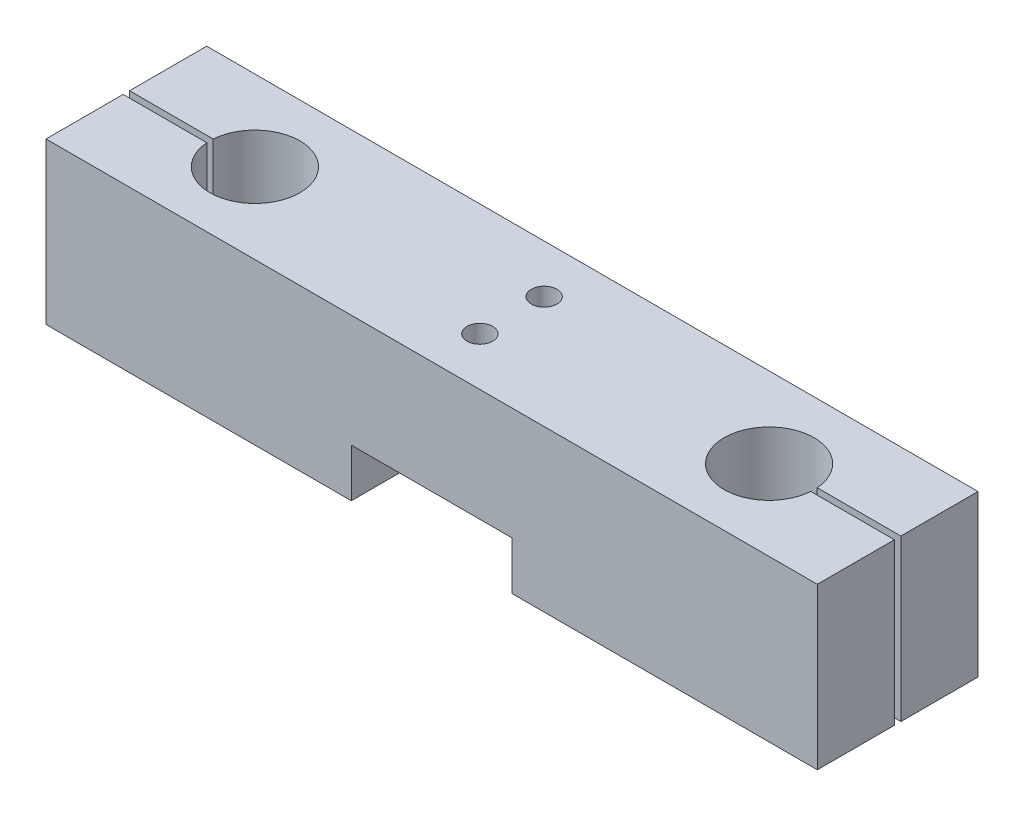
from build123d import *

# Parameters (mm, degrees)
EXTRUDE_1_DEPTH     = 50
SKETCH_3_W          = 50
SKETCH_3_H          = 50
CUT_EXTRUDE_1_DEPTH = 15
SKETCH_4_R          = 4
CUT_EXTRUDE_2_DEPTH = 50


with BuildPart() as part:
    # Эскиз1 → Бобышка-Вытянуть1 (new body)
    with BuildSketch(Plane(origin=(0, 0, 0), x_dir=(1, 0, 0), z_dir=(0, 1, 0))):
        with BuildLine():
            Line((0, 0), (240, 0))
            Line((240, 0), (240, 24))
            Line((240, 24), (213.964240044, 24))
            ThreePointArc((213.964240044, 24), (186, 25), (213.964240044, 26))
            Line((213.964240044, 26), (240, 26))
            Line((240, 26), (240, 50))
            Line((240, 50), (0, 50))
            Line((0, 50), (0, 26))
            Line((0, 26), (26.035759956, 26))
            ThreePointArc((26.035759956, 26), (54, 25), (26.035759956, 24))
            Line((26.035759956, 24), (0, 24))
            Line((0, 24), (0, 0))
        make_face()
    extrude(amount=EXTRUDE_1_DEPTH)

    # Эскиз3 → Вырез-Вытянуть1 (cut)
    with BuildSketch(Plane.XZ):
        with Locations((120, -25)):
            Rectangle(SKETCH_3_W, SKETCH_3_H)
    extrude(amount=-CUT_EXTRUDE_1_DEPTH, mode=Mode.SUBTRACT)

    # Эскиз4 → Вырез-Вытянуть2 (cut)
    with BuildSketch(Plane(origin=(0, 50, 0), x_dir=(1, 0, 0), z_dir=(0, 1, 0))):
        with Locations(Location((120, 35, 0), (0, 0, 270))):
            Circle(SKETCH_4_R)
        with Locations(Location((120, 15, 0), (0, 0, 270))):
            Circle(SKETCH_4_R)
    extrude(amount=-CUT_EXTRUDE_2_DEPTH, mode=Mode.SUBTRACT)


solid = part.part
